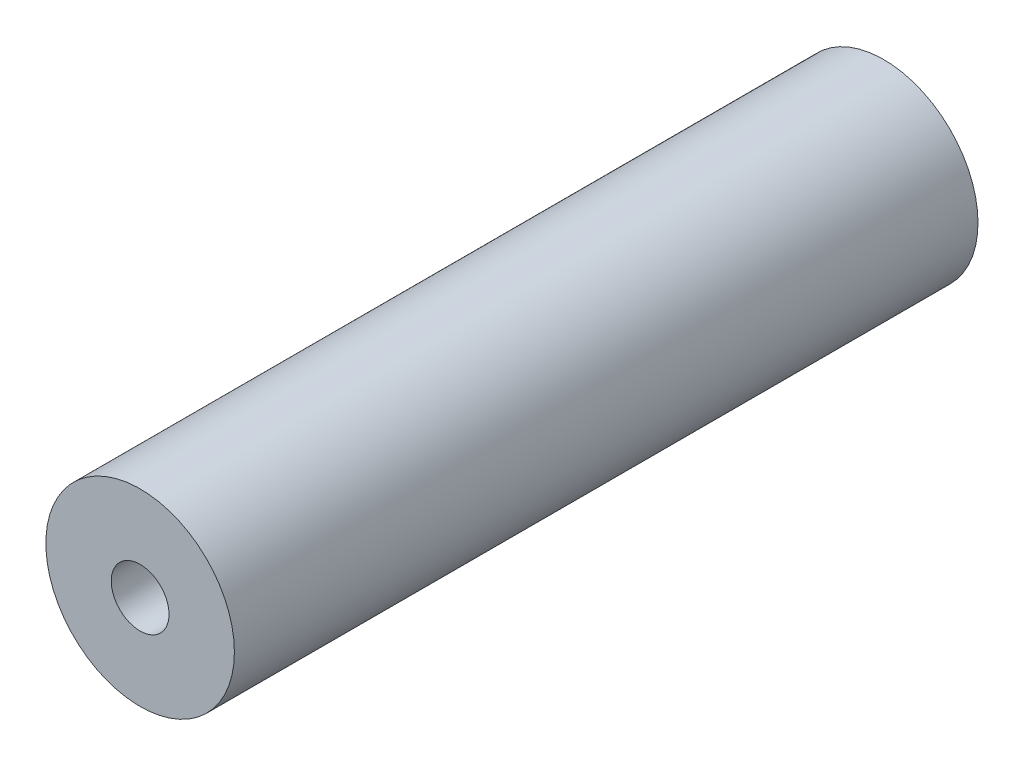
from build123d import *

# Parameters (mm, degrees)
SKETCH1_R           = 8
BOSS_EXTRUDE1_DEPTH = 63.1
SKETCH2_R           = 2.45
CUT_EXTRUDE1_DEPTH  = 10
CUT_EXTRUDE2_START  = -10
SKETCH3_R           = 2.45
CUT_EXTRUDE2_DEPTH  = 10


with BuildPart() as part:
    # Sketch1 → Boss-Extrude1 (new body)
    with BuildSketch(Plane.XY):
        Circle(SKETCH1_R)
    extrude(amount=BOSS_EXTRUDE1_DEPTH)

    # Sketch2 → Cut-Extrude1 (cut)
    with BuildSketch(Plane.XY.offset(63.1)):
        Circle(SKETCH2_R)
    extrude(amount=-CUT_EXTRUDE1_DEPTH, mode=Mode.SUBTRACT)

    # Sketch3 → Cut-Extrude2 (cut)
    with BuildSketch(Plane(origin=(0, 0, 0), x_dir=(-1, 0, 0), z_dir=(0, 0, -1)).offset(CUT_EXTRUDE2_START)):
        with Locations(Location((0, 0, 0), (0, 0, 180))):
            Circle(SKETCH3_R)
    extrude(amount=CUT_EXTRUDE2_DEPTH, mode=Mode.SUBTRACT)


solid = part.part
